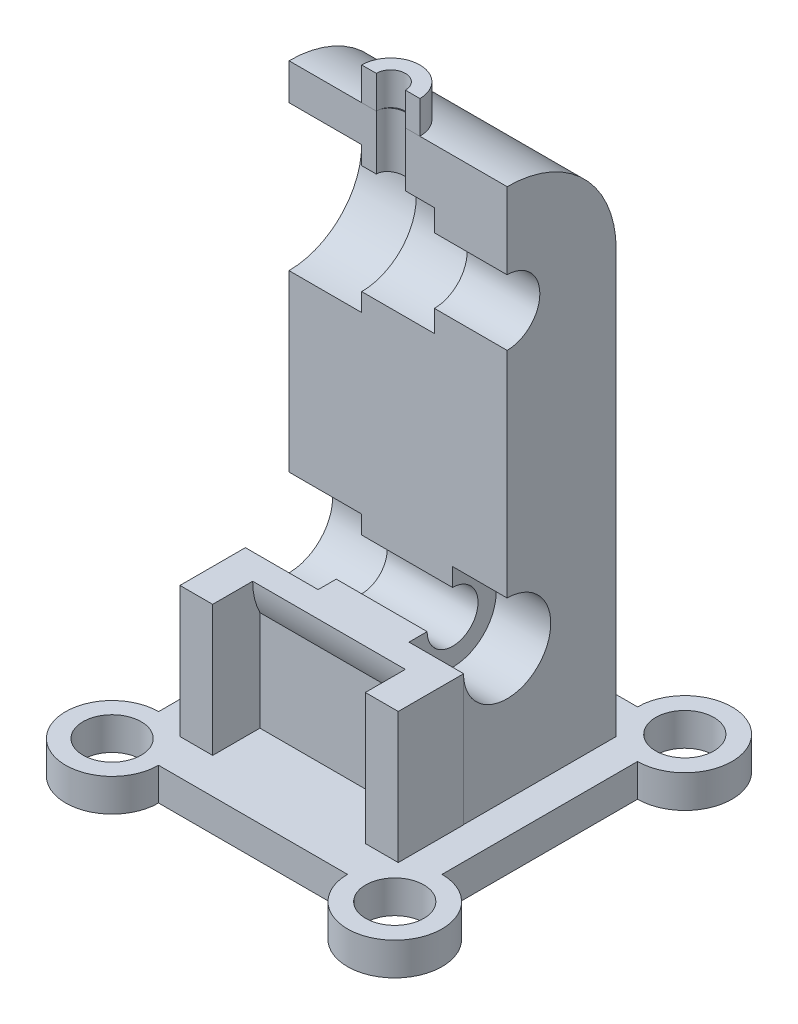
from build123d import *

# Parameters (mm, degrees)
SKETCH1_R            = 8
BOSS_EXTRUDE1_DEPTH  = 9
BOSS_EXTRUDE2_DEPTH  = 36
SKETCH3_W            = 30
SKETCH3_H            = 80
BOSS_EXTRUDE3_DEPTH  = 60
SKETCH4_R            = 12
CUT_EXTRUDE2_DEPTH   = 20
SKETCH5_R            = 7
CUT_EXTRUDE3_DEPTH   = 25
CUT_EXTRUDE4_START   = -15
SKETCH6_R            = 12
CUT_EXTRUDE4_DEPTH   = 15
BOSS_EXTRUDE4_DEPTH  = 36
BOSS_EXTRUDE5_DEPTH  = 60
SKETCH10_R           = 20
CUT_EXTRUDE5_DEPTH   = 60
BOSS_EXTRUDE7_DEPTH  = 60
BOSS_EXTRUDE8_DEPTH  = 40
BOSS_EXTRUDE9_DEPTH  = 20
BOSS_EXTRUDE10_DEPTH = 9
SKETCH20_R           = 4
CUT_EXTRUDE6_DEPTH   = 18


with BuildPart() as part:
    # Sketch1 → Boss-Extrude1 (new body)
    with BuildSketch(Plane(origin=(0, 0, 0), x_dir=(1, 0, 0), z_dir=(0, 1, 0))):
        with BuildLine():
            Line((-62.341648488, 5.322137989), (-10.584107064, 5.322137989))
            ThreePointArc((-10.584107064, 5.322137989), (11.608281092, 14.514526145), (2.415892936, -7.677862011))
            Line((2.415892936, -7.677862011), (2.415892936, -61.464316376))
            ThreePointArc((2.415892936, -61.464316376), (11.608281092, -83.656704531), (-10.584107064, -74.464316376))
            Line((-10.584107064, -74.464316376), (-62.555194123, -74.464316376))
            ThreePointArc((-62.555194123, -74.464316376), (-84.383037077, -83.505704964), (-75.341648488, -61.677862011))
            Line((-75.341648488, -61.677862011), (-75.341648488, -7.677862011))
            ThreePointArc((-75.341648488, -7.677862011), (-84.534036644, 14.514526145), (-62.341648488, 5.322137989))
        make_face()
        with Locations(Location((2.415892936, 5.322137989, 0), (0, 0, 270))):
            Circle(SKETCH1_R, mode=Mode.SUBTRACT)
        with Locations(Location((-75.341648488, 5.322137989, 0), (0, 0, 270))):
            Circle(SKETCH1_R, mode=Mode.SUBTRACT)
        with Locations(Location((-75.341648488, -74.464316376, 0), (0, 0, 270))):
            Circle(SKETCH1_R, mode=Mode.SUBTRACT)
        with Locations(Location((2.415892936, -74.464316376, 0), (0, 0, 270))):
            Circle(SKETCH1_R, mode=Mode.SUBTRACT)
    extrude(amount=BOSS_EXTRUDE1_DEPTH)

    # Sketch2 → Boss-Extrude2 (add)
    with BuildSketch(Plane(origin=(0, 9, 0), x_dir=(1, 0, 0), z_dir=(0, 1, 0))):
        Polygon((-66.462877776, -4.677862011), (-66.462877776, -46.677862011), (-46.462877776, -46.677862011), (-46.462877776, -41.677862011), (-21.462877776, -41.677862011), (-21.462877776, -46.677862011), (-6.462877776, -46.677862011), (-6.462877776, -4.677862011), align=None)
    extrude(amount=BOSS_EXTRUDE2_DEPTH)

    # Sketch3 → Boss-Extrude3 (add)
    with BuildSketch(Plane.ZY.offset(66.462877776)):
        with Locations((19.677862011, 85)):
            Rectangle(SKETCH3_W, SKETCH3_H)
    extrude(amount=-BOSS_EXTRUDE3_DEPTH)

    # Sketch4 → Cut-Extrude2 (cut)
    with BuildSketch(Plane.ZY.offset(66.462877776)):
        with Locations((34.677862011, 45)):
            Circle(SKETCH4_R)
    extrude(amount=-CUT_EXTRUDE2_DEPTH, mode=Mode.SUBTRACT)

    # Sketch5 → Cut-Extrude3 (cut)
    with BuildSketch(Plane.ZY.offset(46.462877776)):
        with Locations((34.677862011, 45)):
            Circle(SKETCH5_R)
    extrude(amount=-CUT_EXTRUDE3_DEPTH, mode=Mode.SUBTRACT)

    # Sketch6 → Cut-Extrude4 (cut)
    with BuildSketch(Plane(origin=(-6.462877776, 0, 0), x_dir=(0, 0, -1), z_dir=(1, 0, 0)).offset(CUT_EXTRUDE4_START)):
        with Locations((-34.677862011, 45)):
            Circle(SKETCH6_R)
    extrude(amount=CUT_EXTRUDE4_DEPTH, mode=Mode.SUBTRACT)

    # Sketch7 → Boss-Extrude4 (add)
    with BuildSketch(Plane(origin=(0, 9, 0), x_dir=(1, 0, 0), z_dir=(0, 1, 0))):
        Polygon((-66.462877776, -46.677862011), (-66.462877776, -64.677862011), (-57.462877776, -64.677862011), (-57.462877776, -51.677862011), (-15.462877776, -51.677862011), (-15.462877776, -64.677862011), (-6.412975689, -64.677862011), (-6.412975689, -46.677862011), (-21.462877776, -46.677862011), (-21.462877776, -41.677862011), (-46.462877776, -41.677862011), (-46.462877776, -46.677862011), align=None)
    extrude(amount=BOSS_EXTRUDE4_DEPTH)

    # Sketch9 → Boss-Extrude5 (add)
    with BuildSketch(Plane.ZY.offset(66.462877776)):
        with BuildLine():
            Line((53.677862011, 45), (46.677862011, 45))
            ThreePointArc((46.677862011, 45), (34.677862011, 33), (22.677862011, 45))
            Line((22.677862011, 45), (15.677862011, 45))
            ThreePointArc((15.677862011, 45), (34.677862011, 26), (53.677862011, 45))
        make_face()
    extrude(amount=-BOSS_EXTRUDE5_DEPTH)

    # Sketch10 → Cut-Extrude5 (cut)
    with BuildSketch(Plane.ZY.offset(66.462877776)):
        with Locations((34.677862011, 125)):
            Circle(SKETCH10_R)
    extrude(amount=-CUT_EXTRUDE5_DEPTH, mode=Mode.SUBTRACT)

    # Sketch11 → Boss-Extrude7 (add)
    with BuildSketch(Plane.ZY.offset(66.462877776)):
        with BuildLine():
            Line((34.677862011, 95), (34.677862011, 105))
            ThreePointArc((34.677862011, 105), (14.677862011, 125), (34.677862011, 145))
            Line((34.677862011, 145), (34.677862011, 155))
            ThreePointArc((34.677862011, 155), (4.677862011, 125), (34.677862011, 95))
        make_face()
    extrude(amount=-BOSS_EXTRUDE7_DEPTH)

    # Sketch17 → Boss-Extrude8 (add)
    with BuildSketch(Plane.ZY.offset(46.462877776)):
        with BuildLine():
            Line((34.677862011, 145), (34.677862011, 140))
            ThreePointArc((34.677862011, 140), (19.677862011, 125), (34.677862011, 110))
            Line((34.677862011, 110), (34.677862011, 105))
            ThreePointArc((34.677862011, 105), (14.677862011, 125), (34.677862011, 145))
        make_face()
    extrude(amount=-BOSS_EXTRUDE8_DEPTH)

    # Sketch18 → Boss-Extrude9 (add)
    with BuildSketch(Plane.ZY.offset(26.462877776)):
        with BuildLine():
            Line((34.677862011, 134), (34.677862011, 140))
            ThreePointArc((34.677862011, 140), (19.677862011, 125), (34.677862011, 110))
            Line((34.677862011, 110), (34.677862011, 116))
            ThreePointArc((34.677862011, 116), (25.677862011, 125), (34.677862011, 134))
        make_face()
    extrude(amount=-BOSS_EXTRUDE9_DEPTH)

    # Sketch20 → Cut-Extrude6 (cut)
    with BuildSketch(Plane(origin=(0, 155, 0), x_dir=(1, 0, 0), z_dir=(0, 1, 0))):
        with Locations((-38.462877776, -34.677862011)):
            Circle(SKETCH20_R)
    extrude(amount=-CUT_EXTRUDE6_DEPTH, mode=Mode.SUBTRACT)


with BuildPart() as body_2:
    # Sketch19 → Boss-Extrude10 (new body)
    with BuildSketch(Plane(origin=(0, 155, 0), x_dir=(1, 0, 0), z_dir=(0, 1, 0))):
        with BuildLine():
            ThreePointArc((-30.462877776, -34.677862011), (-38.462877776, -26.677862011), (-46.462877776, -34.677862011))
            Line((-46.462877776, -34.677862011), (-42.462877776, -34.677862011))
            ThreePointArc((-42.462877776, -34.677862011), (-38.462877776, -30.677862011), (-34.462877776, -34.677862011))
            Line((-34.462877776, -34.677862011), (-30.462877776, -34.677862011))
        make_face()
    extrude(amount=BOSS_EXTRUDE10_DEPTH)


solid = Compound([part.part, body_2.part])
